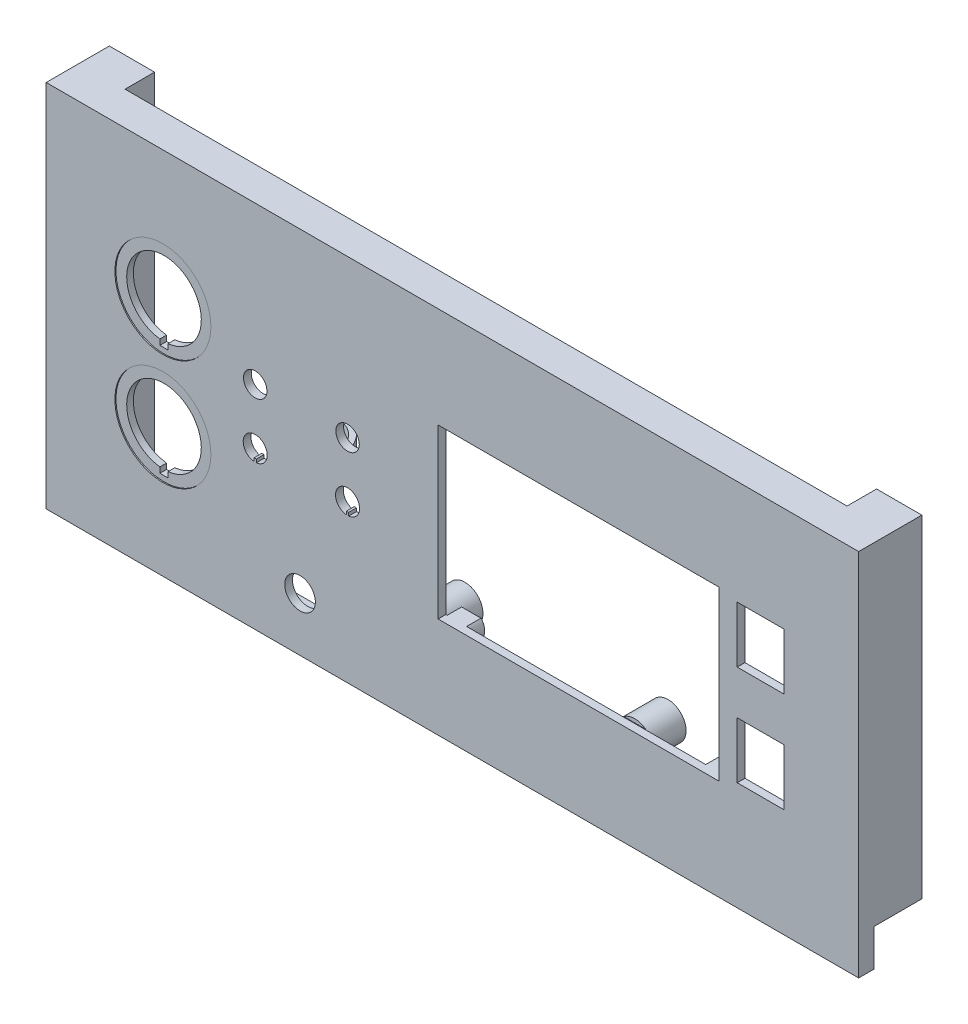
from build123d import *

# Parameters (mm, degrees)
SKETCH1_W             = 220
SKETCH1_H             = 100
FRONT_PANEL_DEPTH     = 2.1
START_STOP_DEPTH      = 121.848707068
SKETCH3_R             = 3.175
MODE_SELECT_DEPTH     = 121.848707068
SKETCH4_W             = 76
SKETCH4_H             = 45.5
LCD_CUTOUT_DEPTH      = 121.848707068
SKETCH6_W             = 12.7
SKETCH6_H             = 15.24
LCD_PUSHBUTTONS_DEPTH = 121.848707068
SKETCH8_W             = 12.25
SKETCH8_H             = 90
SKETCH8_W_2           = 6.25
SKETCH8_H_2           = 84
BOSS_EXTRUDE1_DEPTH   = 15
SKETCH9_R             = 4.9
BOSS_EXTRUDE2_DEPTH   = 15
SKETCH11_R            = 1.625
BOSS_EXTRUDE3_DEPTH   = 3.9
CUT_EXTRUDE1_DEPTH    = 6
SKETCH13_R            = 2.875
CUT_EXTRUDE2_DEPTH    = 4.7
SKETCH14_W            = 195.5
SKETCH14_H            = 3
BOSS_EXTRUDE4_DEPTH   = 7
SKETCH17_R            = 13
CUT_EXTRUDE3_DEPTH    = 0.3
SKETCH18_W            = 220
SKETCH18_H            = 10
BOSS_EXTRUDE5_DEPTH   = 2
SKETCH19_R            = 4.15
CUT_EXTRUDE4_DEPTH    = 123.034462346
BOSS_EXTRUDE6_START   = -48
BOSS_EXTRUDE6_DEPTH   = 3


with BuildPart() as part:
    # Sketch1 → Front panel (new body)
    with BuildSketch(Plane.XY):
        Rectangle(SKETCH1_W, SKETCH1_H)
    extrude(amount=FRONT_PANEL_DEPTH)

    # Sketch2 → Start/stop (cut, through all)
    with BuildSketch(Plane.XY.offset(2.1)):
        with BuildLine():
            Line((-79.499183747, 4.960079682), (-79.499183747, 3.460079682))
            Line((-79.499183747, 3.460079682), (-77.299183747, 3.460079682))
            Line((-77.299183747, 3.460079682), (-77.299183747, 4.960079682))
            ThreePointArc((-77.299183747, 4.960079682), (-78.399183747, 25.1), (-79.499183747, 4.960079682))
        make_face()
        with BuildLine():
            Line((-79.499183747, -25.039920318), (-79.499183747, -26.539920318))
            Line((-79.499183747, -26.539920318), (-77.299183747, -26.539920318))
            Line((-77.299183747, -26.539920318), (-77.299183747, -25.039920318))
            ThreePointArc((-77.299183747, -25.039920318), (-78.399183747, -4.9), (-79.499183747, -25.039920318))
        make_face()
    extrude(amount=-START_STOP_DEPTH, mode=Mode.SUBTRACT)

    # Sketch3 → Mode select (cut, through all)
    with BuildSketch(Plane.XY.offset(2.1)):
        with Locations((-53.399183747, 7.5)):
            Circle(SKETCH3_R)
        with Locations((-28.399183747, 7.5)):
            Circle(SKETCH3_R)
        with BuildLine():
            Line((-53.699183747, -10.736124225), (-53.699183747, -9.85))
            Line((-53.699183747, -9.85), (-53.099183747, -9.85))
            Line((-53.099183747, -9.85), (-53.099183747, -10.736124225))
            ThreePointArc((-53.099183747, -10.736124225), (-53.399183747, -4.25), (-53.699183747, -10.736124225))
        make_face()
        with BuildLine():
            Line((-28.699183747, -10.736124225), (-28.699183747, -9.85))
            Line((-28.699183747, -9.85), (-28.099183747, -9.85))
            Line((-28.099183747, -9.85), (-28.099183747, -10.736124225))
            ThreePointArc((-28.099183747, -10.736124225), (-28.399183747, -4.25), (-28.699183747, -10.736124225))
        make_face()
    extrude(amount=-MODE_SELECT_DEPTH, mode=Mode.SUBTRACT)

    # Sketch4 → LCD cutout (cut, through all)
    with BuildSketch(Plane.XY.offset(2.1)):
        with Locations((34.114239424, 0)):
            Rectangle(SKETCH4_W, SKETCH4_H)
    extrude(amount=-LCD_CUTOUT_DEPTH, mode=Mode.SUBTRACT)

    # Sketch6 → LCD pushbuttons (cut, through all)
    with BuildSketch(Plane.XY.offset(2.1)):
        with Locations((83.464239424, 14.0825)):
            Rectangle(SKETCH6_W, SKETCH6_H)
        with Locations((83.464239424, -13.035)):
            Rectangle(SKETCH6_W, SKETCH6_H)
    extrude(amount=-LCD_PUSHBUTTONS_DEPTH, mode=Mode.SUBTRACT)

    # Sketch8 → Boss-Extrude1 (add)
    # profile 1 of 2: a face of its own
    with BuildSketch(Plane(origin=(0, 0, 0), x_dir=(-1, 0, 0), z_dir=(0, 0, -1))):
        with Locations((-103.875, 5)):
            Rectangle(SKETCH8_W, SKETCH8_H)
        with Locations((-103.875, 5)):
            Rectangle(SKETCH8_W_2, SKETCH8_H_2, mode=Mode.SUBTRACT)
    # profile 2 of 2: a face of its own
    with BuildSketch(Plane(origin=(0, 0, 0), x_dir=(-1, 0, 0), z_dir=(0, 0, -1))):
        with Locations((103.875, 5)):
            Rectangle(SKETCH8_W, SKETCH8_H)
        with Locations((103.875, 5)):
            Rectangle(SKETCH8_W_2, SKETCH8_H_2, mode=Mode.SUBTRACT)
    extrude(amount=BOSS_EXTRUDE1_DEPTH)

    # Sketch9 → Boss-Extrude2 (add)
    with BuildSketch(Plane(origin=(0, 0, 0), x_dir=(-1, 0, 0), z_dir=(0, 0, -1))):
        with Locations(Location((-41.273799242, -32.5, 0), (0, 0, 180))):
            Circle(SKETCH9_R)
        with Locations(Location((13.726200758, -32.5, 0), (0, 0, 180))):
            Circle(SKETCH9_R)
        with Locations(Location((13.726200758, 17.5, 0), (0, 0, 180))):
            Circle(SKETCH9_R)
        with Locations(Location((-41.273799242, 32.5, 0), (0, 0, 180))):
            Circle(SKETCH9_R)
    extrude(amount=BOSS_EXTRUDE2_DEPTH)

    # Sketch11 → Boss-Extrude3 (add)
    # profile 1 of 4: a face of its own
    with BuildSketch(Plane(origin=(0, 0, 0), x_dir=(-1, 0, 0), z_dir=(0, 0, -1))):
        with BuildLine():
            Line((-71.739239424, 22.75), (-66.489239424, 22.75))
            ThreePointArc((-66.489239424, 22.75), (-69.114239424, 28.875), (-71.739239424, 22.75))
        make_face()
        with Locations(Location((-69.114239424, 25.25, 0), (0, 0, 180))):
            Circle(SKETCH11_R, mode=Mode.SUBTRACT)
    # profile 2 of 4: a face of its own
    with BuildSketch(Plane(origin=(0, 0, 0), x_dir=(-1, 0, 0), z_dir=(0, 0, -1))):
        with BuildLine():
            Line((3.510760576, -22.75), (-1.739239424, -22.75))
            ThreePointArc((-1.739239424, -22.75), (0.885760576, -28.875), (3.510760576, -22.75))
        make_face()
        with Locations(Location((0.885760576, -25.25, 0), (0, 0, 180))):
            Circle(SKETCH11_R, mode=Mode.SUBTRACT)
    # profile 3 of 4: a face of its own
    with BuildSketch(Plane(origin=(0, 0, 0), x_dir=(-1, 0, 0), z_dir=(0, 0, -1))):
        with BuildLine():
            Line((-66.489239424, -22.75), (-71.739239424, -22.75))
            ThreePointArc((-71.739239424, -22.75), (-69.114239424, -28.875), (-66.489239424, -22.75))
        make_face()
        with Locations(Location((-69.114239424, -25.25, 0), (0, 0, 180))):
            Circle(SKETCH11_R, mode=Mode.SUBTRACT)
    # profile 4 of 4: a face of its own
    with BuildSketch(Plane(origin=(0, 0, 0), x_dir=(-1, 0, 0), z_dir=(0, 0, -1))):
        with BuildLine():
            Line((-1.739239424, 22.75), (3.510760576, 22.75))
            ThreePointArc((3.510760576, 22.75), (0.885760576, 28.875), (-1.739239424, 22.75))
        make_face()
        with Locations(Location((0.885760576, 25.25, 0), (0, 0, 180))):
            Circle(SKETCH11_R, mode=Mode.SUBTRACT)
    extrude(amount=BOSS_EXTRUDE3_DEPTH)

    # Sketch12 → Cut-Extrude1 (cut)
    with BuildSketch(Plane(origin=(0, 0, 0), x_dir=(-1, 0, 0), z_dir=(0, 0, -1))):
        with BuildLine():
            Line((-44.240278637, -28.6), (-38.307319848, -28.6))
            ThreePointArc((-38.307319848, -28.6), (-41.273799242, -27.6), (-44.240278637, -28.6))
        make_face()
    extrude(amount=CUT_EXTRUDE1_DEPTH, mode=Mode.SUBTRACT)

    # Sketch13 → Cut-Extrude2 (cut)
    with BuildSketch(Plane(origin=(0, 0, -15), x_dir=(-1, 0, 0), z_dir=(0, 0, -1))):
        with Locations((13.726200758, -32.5)):
            Circle(SKETCH13_R)
        with Locations((-41.273799242, -32.5)):
            Circle(SKETCH13_R)
        with Locations((-41.273799242, 32.5)):
            Circle(SKETCH13_R)
        with Locations((13.726200758, 17.5)):
            Circle(SKETCH13_R)
    extrude(amount=-CUT_EXTRUDE2_DEPTH, mode=Mode.SUBTRACT)

    # Sketch14 → Boss-Extrude4 (add)
    with BuildSketch(Plane(origin=(0, 0, 0), x_dir=(-1, 0, 0), z_dir=(0, 0, -1))):
        with Locations((0, 48.5)):
            Rectangle(SKETCH14_W, SKETCH14_H)
    extrude(amount=BOSS_EXTRUDE4_DEPTH)

    # Sketch17 → Cut-Extrude3 (cut)
    with BuildSketch(Plane.XY.offset(2.1)):
        with Locations((-78.399183747, 15)):
            Circle(SKETCH17_R)
        with Locations((-78.399183747, -15)):
            Circle(SKETCH17_R)
    extrude(amount=-CUT_EXTRUDE3_DEPTH, mode=Mode.SUBTRACT)

    # Sketch18 → Boss-Extrude5 (add)
    with BuildSketch(Plane(origin=(0, 0, 0), x_dir=(-1, 0, 0), z_dir=(0, 0, -1))):
        with Locations((0, -45)):
            Rectangle(SKETCH18_W, SKETCH18_H)
    extrude(amount=BOSS_EXTRUDE5_DEPTH)

    # Sketch19 → Cut-Extrude4 (cut, through all)
    with BuildSketch(Plane.XY.offset(2.1)):
        with Locations((-41.25915054, -35.402356649)):
            Circle(SKETCH19_R)
    extrude(amount=-CUT_EXTRUDE4_DEPTH, mode=Mode.SUBTRACT)


with BuildPart() as body_2:
    # Sketch20 → Boss-Extrude6 (new body)
    with BuildSketch(Plane(origin=(0, 50, 0), x_dir=(1, 0, 0), z_dir=(0, 1, 0)).offset(BOSS_EXTRUDE6_START)):
        with BuildLine():
            Line((-48.854511876, 0), (-47.341700482, 0))
            ThreePointArc((-47.341700482, 0), (-39.841700482, 6.5), (-32.341700482, 0))
            Line((-32.341700482, 0), (-30.828889087, 0))
            ThreePointArc((-30.828889087, 0), (-39.841700482, 8), (-48.854511876, 0))
        make_face()
    extrude(amount=-BOSS_EXTRUDE6_DEPTH)


solid = Compound([part.part, body_2.part])
